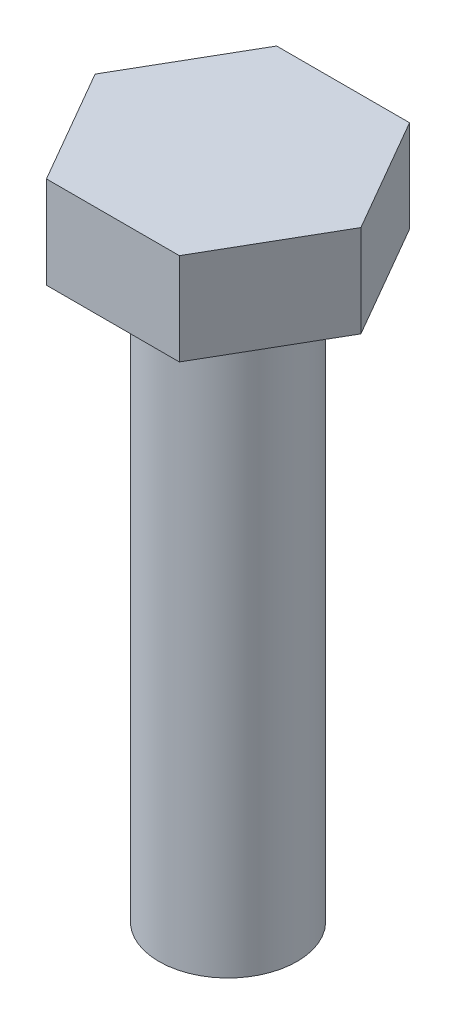
from build123d import *

# Parameters (mm, degrees)
SHANK_PROFILE_R = 3
SHANK_DEPTH     = 25
HEAD_START      = 25
HEAD_DEPTH      = 4


with BuildPart() as part:
    # Shank Profile → Shank (new body)
    with BuildSketch(Plane(origin=(0, 0, 0), x_dir=(1, 0, 0), z_dir=(0, 1, 0))):
        with Locations(Location((0, 0, 0), (0, 0, 270))):
            Circle(SHANK_PROFILE_R)
    extrude(amount=SHANK_DEPTH)

    # Head Profile → Head (add)
    with BuildSketch(Plane(origin=(0, 0, 0), x_dir=(1, 0, 0), z_dir=(0, 1, 0)).offset(HEAD_START)):
        Polygon((5.773502692, 0), (2.886751346, -5), (-2.886751346, -5), (-5.773502692, 0), (-2.886751346, 5), (2.886751346, 5), align=None)
    extrude(amount=HEAD_DEPTH)


solid = part.part
